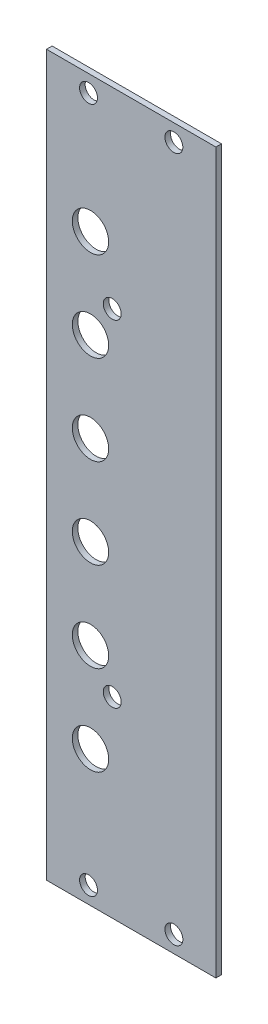
from build123d import *

# Parameters (mm, degrees)
SKETCH2_W                        = 30.24
SKETCH2_H                        = 128.5
SKETCH2_R                        = 1.6
BOSS_EXTRUDE1_DEPTH              = 1
SMA_CUTS_DEPTH                   = 133.014043192
SMA_CUTS_DEPTH_BACK              = 133.014043192
SKETCH3_R                        = 3.25
MOUNTING_BRACKET_CUTS_DEPTH      = 133.014043192
MOUNTING_BRACKET_CUTS_DEPTH_BACK = 133.014043192
SKETCH4_R                        = 1.6


with BuildPart() as part:
    # Sketch2 → Boss-Extrude1 (new body)
    with BuildSketch(Plane.XY):
        with Locations((15.12, 64.25)):
            Rectangle(SKETCH2_W, SKETCH2_H)
        with Locations((7.5, 3)):
            Circle(SKETCH2_R, mode=Mode.SUBTRACT)
        with Locations((22.74, 3)):
            Circle(SKETCH2_R, mode=Mode.SUBTRACT)
        with Locations((22.74, 125.5)):
            Circle(SKETCH2_R, mode=Mode.SUBTRACT)
        with Locations((7.5, 125.5)):
            Circle(SKETCH2_R, mode=Mode.SUBTRACT)
    extrude(amount=BOSS_EXTRUDE1_DEPTH)

    # Sketch3 → sma_cuts (cut, two sides: drawn at the far end of the back side and taken through both)
    with BuildSketch(Plane.XY.offset(1).offset(-SMA_CUTS_DEPTH_BACK)):
        with Locations((7.85, 104.25)):
            Circle(SKETCH3_R)
        with Locations((7.85, 88.25)):
            Circle(SKETCH3_R)
        with Locations((7.85, 72.25)):
            Circle(SKETCH3_R)
        with Locations((7.85, 56.25)):
            Circle(SKETCH3_R)
        with Locations((7.85, 40.25)):
            Circle(SKETCH3_R)
        with Locations((7.85, 24.25)):
            Circle(SKETCH3_R)
    extrude(amount=SMA_CUTS_DEPTH + SMA_CUTS_DEPTH_BACK, mode=Mode.SUBTRACT)

    # Sketch4 → mounting_bracket_cuts (cut, two sides: drawn at the far end of the back side and taken through both)
    with BuildSketch(Plane.XY.offset(1).offset(-MOUNTING_BRACKET_CUTS_DEPTH_BACK)):
        with Locations((11.7314, 94.225)):
            Circle(SKETCH4_R)
        with Locations((11.7314, 34.225)):
            Circle(SKETCH4_R)
    extrude(amount=MOUNTING_BRACKET_CUTS_DEPTH + MOUNTING_BRACKET_CUTS_DEPTH_BACK, mode=Mode.SUBTRACT)


solid = part.part
